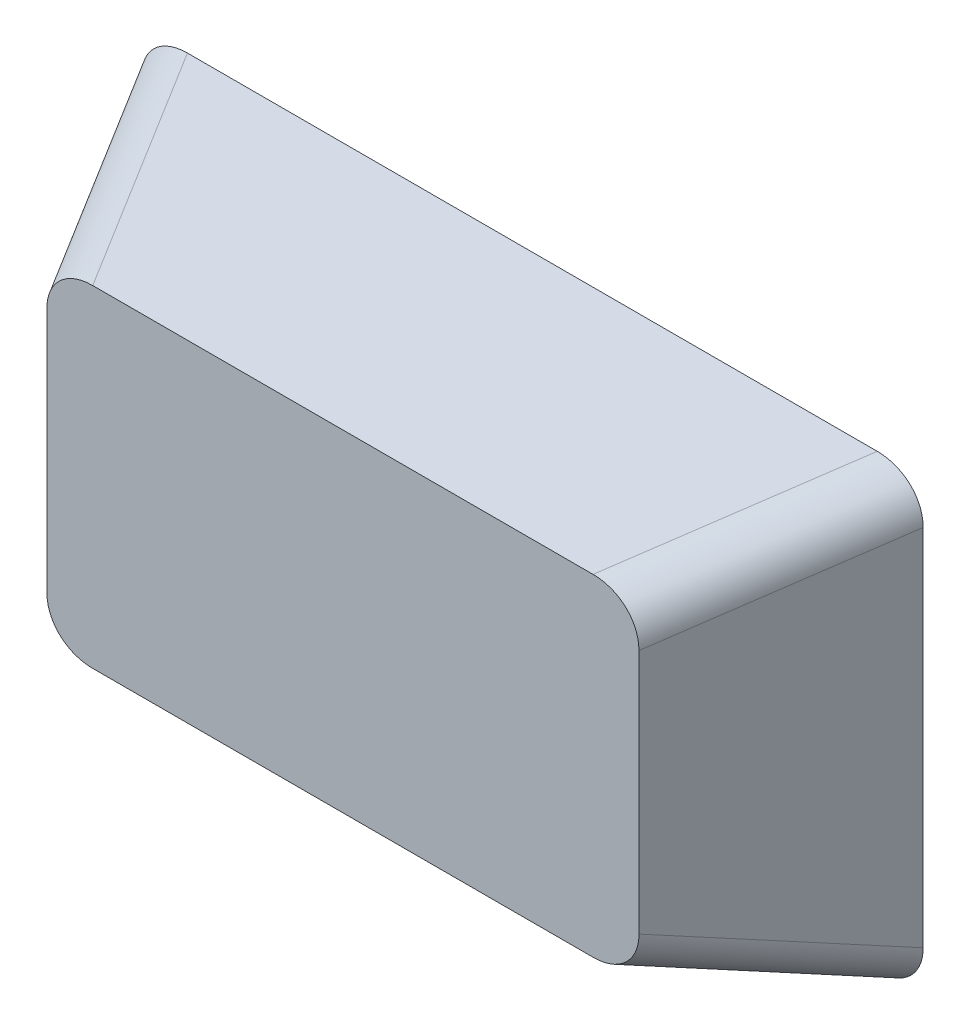
from build123d import *

# Parameters (mm, degrees)
FILLET1_R = 10


with BuildPart() as part:
    # Sketch3 → Loft1 section 0
    with BuildSketch(Plane.XY):
        with BuildLine():
            Line((62.5, -35), (-62.5, -35))
            Line((-62.5, -35), (-62.5, 35))
            Line((-62.5, 35), (62.5, 35))
            Line((62.5, 35), (62.5, -35))
        make_face()
    # Sketch4 → Loft1 section 1
    with BuildSketch(Plane.XY.offset(-40)):
        with BuildLine():
            Line((82.5, -47.5), (-82.5, -47.5))
            Line((-82.5, -47.5), (-82.5, 47.5))
            Line((-82.5, 47.5), (82.5, 47.5))
            Line((82.5, 47.5), (82.5, -47.5))
        make_face()
    loft()

    # Sketch7 → Cut-Loft2 section 0
    with BuildSketch(Plane.XY.offset(-40)):
        with BuildLine():
            Line((77.5, -42.5), (-77.5, -42.5))
            Line((-77.5, -42.5), (-77.5, 42.5))
            Line((-77.5, 42.5), (77.5, 42.5))
            Line((77.5, 42.5), (77.5, -42.5))
        make_face()
    # Sketch5 → Cut-Loft2 section 1
    with BuildSketch(Plane.XY.offset(-20)):
        with BuildLine():
            Line((22.5, -12.5), (-22.5, -12.5))
            Line((-22.5, -12.5), (-22.5, 12.5))
            Line((-22.5, 12.5), (22.5, 12.5))
            Line((22.5, 12.5), (22.5, -12.5))
        make_face()
    loft(mode=Mode.SUBTRACT)

    # Fillet1
    fillet1_edges = [part.edges().sort_by_distance(p)[0] for p in [
        (-72.5, -41.25, -20),
        (-72.5, 41.25, -20),
        (72.5, -41.25, -20),
        (72.5, 41.25, -20),
    ]]
    fillet(fillet1_edges, radius=FILLET1_R)


solid = part.part
